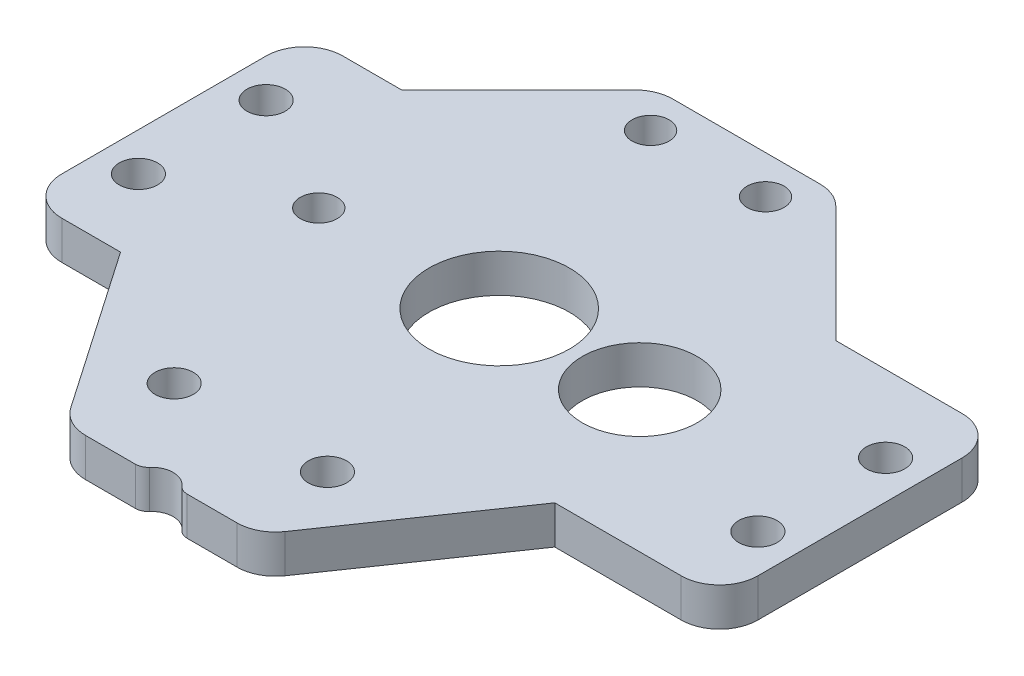
from build123d import *

# Parameters (mm, degrees)
SALIENTE_EXTRUIR1_DEPTH = 3
CROQUIS_BARRIDOS_R      = 1.45
CROQUIS_BARRIDOS_R_2    = 5.5
CROQUIS_BARRIDOS_R_3    = 4.5
CROQUIS_BARRIDOS_R_4    = 1.5
CORTAR_EXTRUIR1_DEPTH   = 3
REDONDEO1_R             = 3
REDONDEO2_R             = 1


with BuildPart() as part:
    # Croquis base → Saliente-Extruir1 (new body)
    with BuildSketch(Plane(origin=(0, 0, 0), x_dir=(1, 0, 0), z_dir=(0, 1, 0))):
        Polygon((-27.25, 11), (-19.65, 11), (-9.65, 21), (4.35, 21), (14.35, 11), (27.25, 11), (27.25, -11), (14.35, -11), (4.85, -24.8), (-10.15, -24.8), (-19.65, -11), (-27.25, -11), align=None)
    extrude(amount=SALIENTE_EXTRUIR1_DEPTH)

    # Croquis barridos → Cortar-Extruir1 (cut)
    with BuildSketch(Plane(origin=(0, 3, 0), x_dir=(1, 0, 0), z_dir=(0, 1, 0))):
        with Locations(Location((-14.88, -0.25, 0), (0, 0, 270))):
            Circle(CROQUIS_BARRIDOS_R)
        with Locations(Location((-1, 0, 0), (0, 0, 270))):
            Circle(CROQUIS_BARRIDOS_R_2)
        with Locations(Location((10, 0, 0), (0, 0, 270))):
            Circle(CROQUIS_BARRIDOS_R_3)
        with Locations(Location((-24.25, 5, 0), (0, 0, 270))):
            Circle(CROQUIS_BARRIDOS_R_4)
        with Locations(Location((24.25, 5, 0), (0, 0, 90))):
            Circle(CROQUIS_BARRIDOS_R_4)
        with Locations(Location((24.25, -5, 0), (0, 0, 270))):
            Circle(CROQUIS_BARRIDOS_R_4)
        with Locations(Location((-24.25, -5, 0), (0, 0, 90))):
            Circle(CROQUIS_BARRIDOS_R_4)
        with Locations(Location((-8.65, -17.8, 0), (0, 0, 270))):
            Circle(CROQUIS_BARRIDOS_R_4)
        with Locations(Location((-7.15, 18, 0), (0, 0, 270))):
            Circle(CROQUIS_BARRIDOS_R)
        with Locations(Location((3.35, -17.8, 0), (0, 0, 90))):
            Circle(CROQUIS_BARRIDOS_R_4)
        with Locations(Location((1.85, 18, 0), (0, 0, 90))):
            Circle(CROQUIS_BARRIDOS_R)
        with BuildLine():
            Line((-4.15, -24.8), (-1.15, -24.8))
            ThreePointArc((-1.15, -24.8), (-2.65, -23.877), (-4.15, -24.8))
        make_face()
    extrude(amount=-CORTAR_EXTRUIR1_DEPTH, mode=Mode.SUBTRACT)

    # Redondeo1
    redondeo1_edges = [part.edges().sort_by_distance(p)[0] for p in [
        (4.85, 1.5, 24.8),
        (-10.15, 1.5, 24.8),
        (-27.25, 1.5, 11),
        (-27.25, 1.5, -11),
        (-9.65, 1.5, -21),
        (4.35, 1.5, -21),
        (27.25, 1.5, -11),
        (27.25, 1.5, 11),
    ]]
    fillet(redondeo1_edges, radius=REDONDEO1_R)

    # Redondeo2
    redondeo2_edges = [part.edges().sort_by_distance(p)[0] for p in [
        (-4.15, 1.5, 24.8),
        (-1.15, 1.5, 24.8),
    ]]
    fillet(redondeo2_edges, radius=REDONDEO2_R)


solid = part.part
